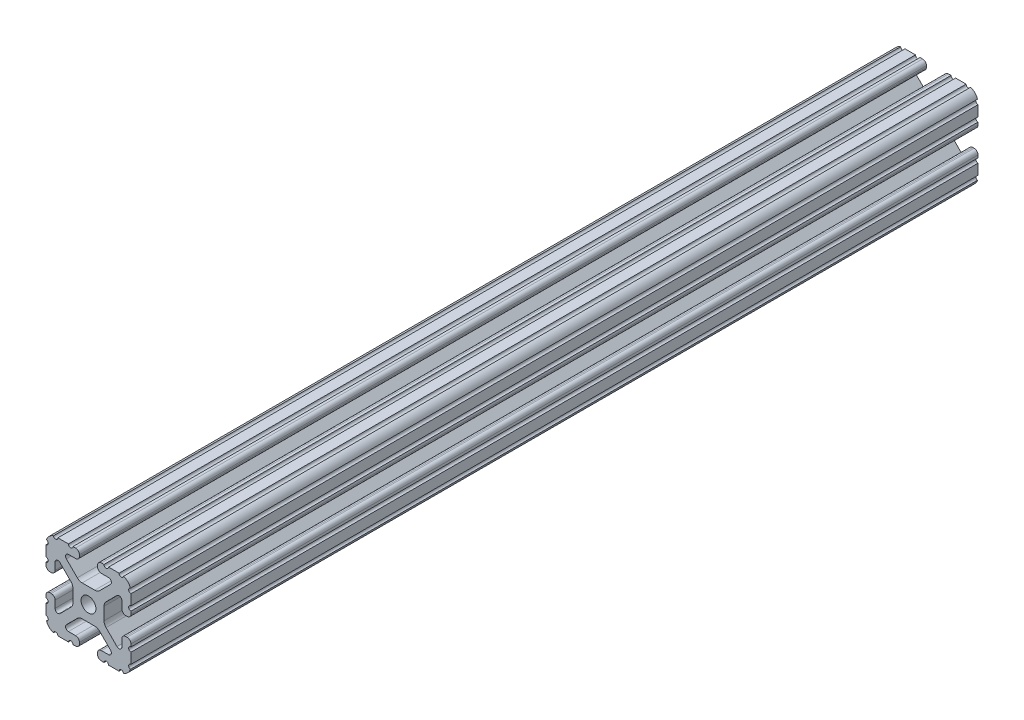
from build123d import *

# Parameters (mm, degrees)
BOSS_EXTRUDE1_DEPTH     = 190
CUT_EXTRUDE1_DEPTH      = 192.900508076
CUT_EXTRUDE1_DEPTH_BACK = 192.900508076
SKETCH5_R               = 1.016


with BuildPart() as part:
    # Sketch4 → Boss-Extrude1 (new, symmetric)
    with BuildSketch(Plane.XY):
        with BuildLine():
            Line((5.7912, -19.05), (14.3002, -19.05))
            ThreePointArc((14.3002, -19.05), (17.658815789, -17.658815789), (19.05, -14.3002))
            Line((19.05, -14.3002), (19.05, -5.7912))
            ThreePointArc((19.05, -5.7912), (18.544114832, -4.569885168), (17.3228, -4.064))
            Line((17.3228, -4.064), (16.7132, -4.064))
            ThreePointArc((16.7132, -4.064), (15.491885168, -4.569885168), (14.986, -5.7912))
            Line((14.986, -5.7912), (14.986, -8.996305235))
            ThreePointArc((14.986, -8.996305235), (14.189232738, -10.188751711), (12.782646215, -9.908964256))
            Line((12.782646215, -9.908964256), (7.888897763, -5.015215804))
            ThreePointArc((7.888897763, -5.015215804), (7.219915375, -4.014012907), (6.985, -2.833013566))
            Line((6.985, -2.833013566), (6.985, 0))
            Line((6.985, 0), (3.3274, 0))
            ThreePointArc((3.3274, 0), (2.352827104, -2.352827104), (0, -3.3274))
            Line((0, -3.3274), (0, -6.985))
            Line((0, -6.985), (2.833013566, -6.985))
            ThreePointArc((2.833013566, -6.985), (4.014012907, -7.219915375), (5.015215804, -7.888897763))
            Line((5.015215804, -7.888897763), (9.908964256, -12.782646215))
            ThreePointArc((9.908964256, -12.782646215), (10.188751711, -14.189232738), (8.996305235, -14.986))
            Line((8.996305235, -14.986), (5.7912, -14.986))
            ThreePointArc((5.7912, -14.986), (4.569885168, -15.491885168), (4.064, -16.7132))
            Line((4.064, -16.7132), (4.064, -17.3228))
            ThreePointArc((4.064, -17.3228), (4.569885168, -18.544114832), (5.7912, -19.05))
        make_face()
    extrude(amount=BOSS_EXTRUDE1_DEPTH, both=True)

    # Sketch5 → Cut-Extrude1 (cut, two sides: drawn at the far end of the back side and taken through both)
    with BuildSketch(Plane.XY.offset(-CUT_EXTRUDE1_DEPTH_BACK)):
        with Locations((14.739477062, -19.05)):
            Circle(SKETCH5_R)
        with Locations((7.980305235, -19.05)):
            Circle(SKETCH5_R)
        with Locations((19.05, -14.739477062)):
            Circle(SKETCH5_R)
        with Locations((19.05, -7.980305235)):
            Circle(SKETCH5_R)
    extrude(amount=CUT_EXTRUDE1_DEPTH + CUT_EXTRUDE1_DEPTH_BACK, mode=Mode.SUBTRACT)

    # Mirror1: part across plane


with BuildPart() as part_1:
    add(part.part)
    add(part.part.mirror(Plane(origin=(0, 0, 0), x_dir=(0, 0, 1), z_dir=(1, 0, 0))))

    # Mirror2: part across plane


with BuildPart() as part_2:
    add(part_1.part)
    add(part_1.part.mirror(Plane.ZX))


solid = part_2.part
